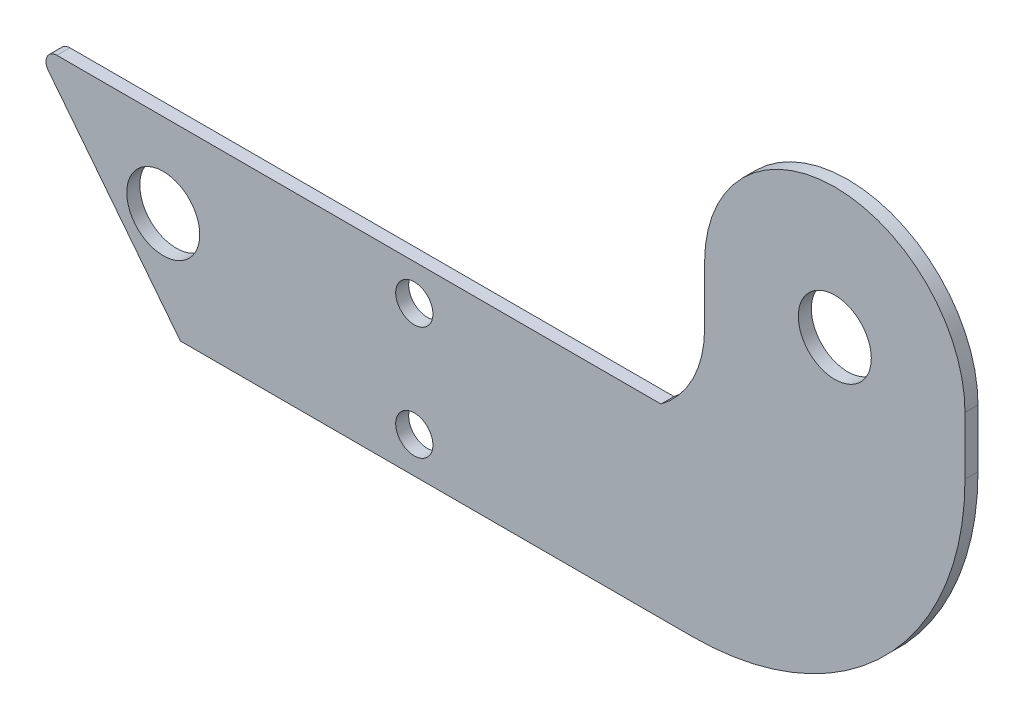
from build123d import *

# Parameters (mm, degrees)
ESBO_O1_R                = 5.05
ESBO_O1_R_2              = 2.574080602
RESSALTO_EXTRUS_O1_DEPTH = 1.8
FILETE1_R                = 1.5


with BuildPart() as part:
    # Esboço1 → Ressalto-extrusão1 (new body)
    with BuildSketch(Plane.XY):
        with BuildLine():
            Line((-18.018564211, 0), (-18.018564211, -8))
            ThreePointArc((-18.018564211, -8), (-19.612515049, -14.728881473), (-24.055610328, -20.027695444))
            Line((-24.055610328, -20.027695444), (-110.751402368, -20.027695444))
            Line((-110.751402368, -20.027695444), (-90.566598558, -45.733186479))
            Line((-90.566598558, -45.733186479), (-19.714622268, -45.733186479))
            ThreePointArc((-19.714622268, -45.733186479), (6.966769767, -34.681392035), (18.018564211, -8))
            Line((18.018564211, -8), (18.018564211, 0))
            ThreePointArc((18.018564211, 0), (0, 18.018564211), (-18.018564211, 0))
        make_face()
        Circle(ESBO_O1_R, mode=Mode.SUBTRACT)
        with Locations((-58.195334888, -25.027695444)):
            Circle(ESBO_O1_R_2, mode=Mode.SUBTRACT)
        with Locations((-58.195334888, -40.733186479)):
            Circle(ESBO_O1_R_2, mode=Mode.SUBTRACT)
        with Locations((-92.938010051, -31.639994649)):
            Circle(ESBO_O1_R, mode=Mode.SUBTRACT)
    extrude(amount=RESSALTO_EXTRUS_O1_DEPTH)

    # Filete1
    filete1_edges = [part.edges().sort_by_distance(p)[0] for p in [
        (-110.751402368, -20.027695444, 0.9),
    ]]
    fillet(filete1_edges, radius=FILETE1_R)


solid = part.part
